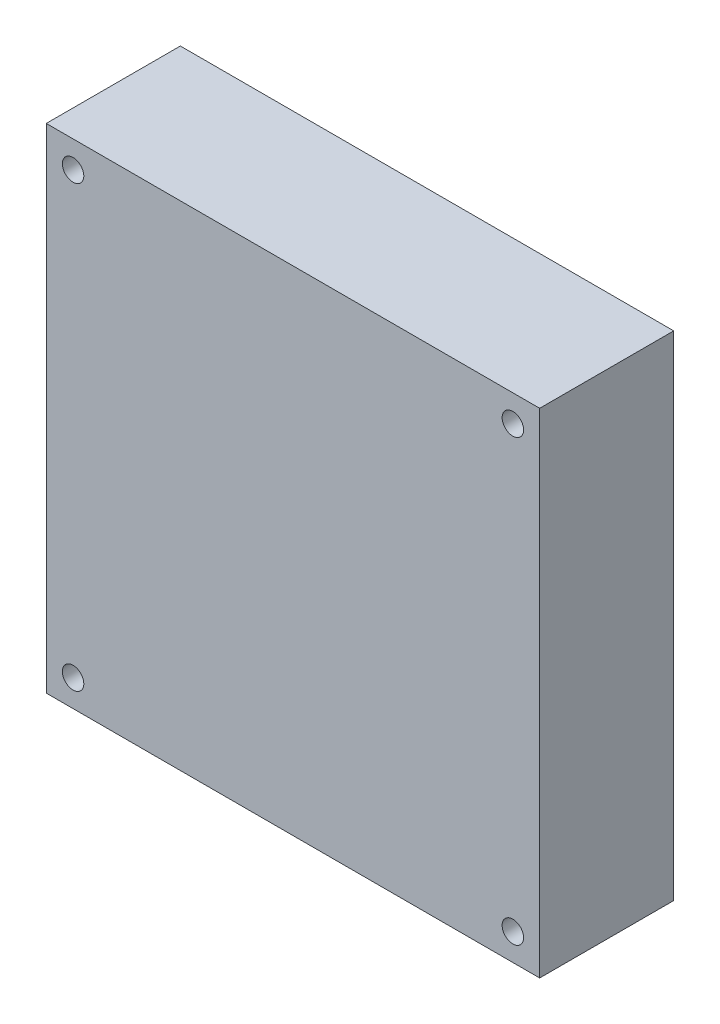
from build123d import *

# Parameters (mm, degrees)
SKETCH_1_W      = 92
SKETCH_1_H      = 92
SKETCH_1_R      = 2
EXTRUDE_1_DEPTH = 25


with BuildPart() as part:
    # Эскиз1 → Бобышка-Вытянуть1 (new body)
    with BuildSketch(Plane.XY):
        with Locations((46, 46)):
            Rectangle(SKETCH_1_W, SKETCH_1_H)
        with Locations((5, 87)):
            Circle(SKETCH_1_R, mode=Mode.SUBTRACT)
        with Locations((87, 87)):
            Circle(SKETCH_1_R, mode=Mode.SUBTRACT)
        with Locations((87, 5)):
            Circle(SKETCH_1_R, mode=Mode.SUBTRACT)
        with Locations((5, 5)):
            Circle(SKETCH_1_R, mode=Mode.SUBTRACT)
    extrude(amount=EXTRUDE_1_DEPTH)


solid = part.part
